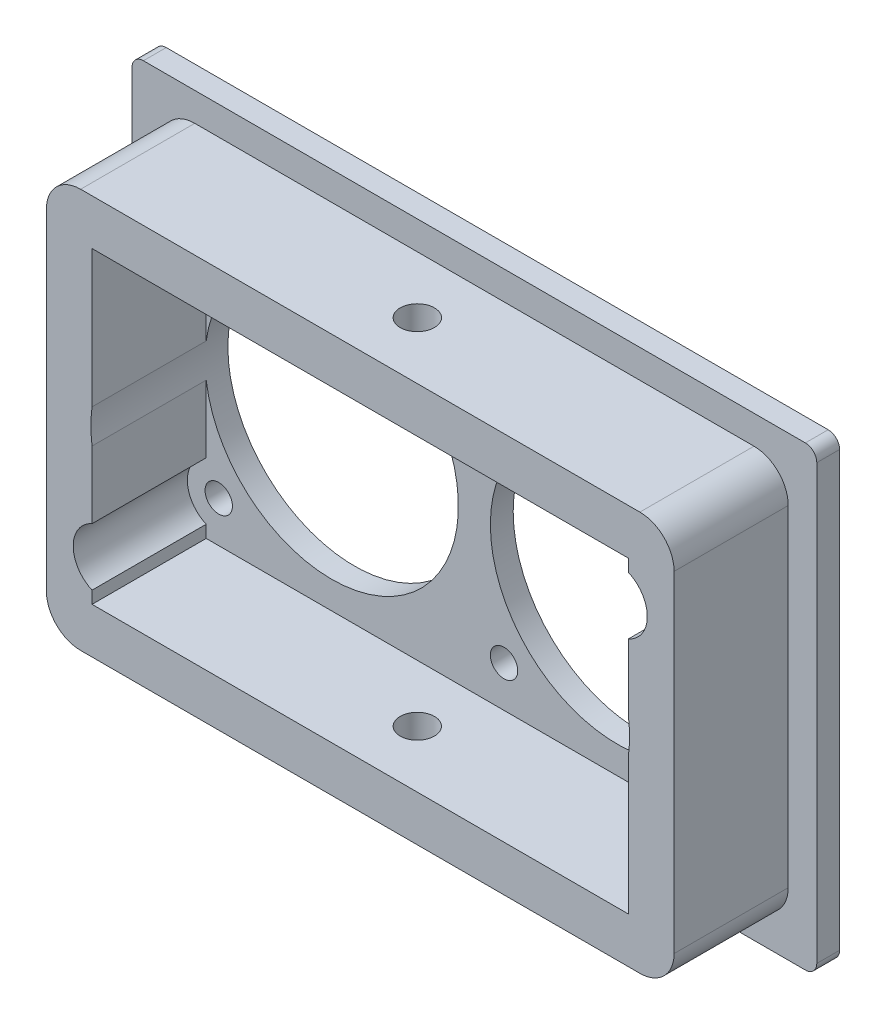
from build123d import *

# Parameters (mm, degrees)
ESQUISSE1_W             = 60
ESQUISSE1_H             = 40
BOSS_EXTRU_1_DEPTH      = 2
ESQUISSE2_W             = 55
ESQUISSE2_H             = 35
BOSS_EXTRU_2_DEPTH      = 10
CONG_1_R                = 3
CONG_2_R                = 1
ESQUISSE3_W             = 47
ESQUISSE3_H             = 27
ENL_V_MAT_EXTRU_1_DEPTH = 10
ESQUISSE4_R             = 1.5
ENL_V_MAT_EXTRU_2_DEPTH = 72.765242283
ESQUISSE5_R             = 11.1
ESQUISSE5_R_2           = 1.2
ENL_V_MAT_EXTRU_3_DEPTH = 74.10266753
ESQUISSE6_R             = 2.75
ENL_V_MAT_EXTRU_4_DEPTH = 73.801098893


with BuildPart() as part:
    # Esquisse1 → Boss.-Extru.1 (new body)
    with BuildSketch(Plane.XY):
        with Locations((30, 20)):
            Rectangle(ESQUISSE1_W, ESQUISSE1_H)
    extrude(amount=BOSS_EXTRU_1_DEPTH)

    # Esquisse2 → Boss.-Extru.2 (add)
    with BuildSketch(Plane.XY.offset(2)):
        with Locations((30, 20)):
            Rectangle(ESQUISSE2_W, ESQUISSE2_H)
    extrude(amount=BOSS_EXTRU_2_DEPTH)

    # Congé1
    cong_1_edges = [part.edges().sort_by_distance(p)[0] for p in [
        (57.5, 37.5, 7),
        (2.5, 37.5, 7),
        (2.5, 2.5, 7),
        (57.5, 2.5, 7),
    ]]
    fillet(cong_1_edges, radius=CONG_1_R)

    # Congé2
    cong_2_edges = [part.edges().sort_by_distance(p)[0] for p in [
        (0, 40, 1),
        (60, 40, 1),
        (60, 0, 1),
        (0, 0, 1),
    ]]
    fillet(cong_2_edges, radius=CONG_2_R)

    # Esquisse3 → Enlèv. mat.-Extru.1 (cut)
    with BuildSketch(Plane.XY.offset(12)):
        with Locations((30, 20)):
            Rectangle(ESQUISSE3_W, ESQUISSE3_H)
    extrude(amount=-ENL_V_MAT_EXTRU_1_DEPTH, mode=Mode.SUBTRACT)

    # Esquisse4 → Enlèv. mat.-Extru.2 (cut, through all)
    with BuildSketch(Plane(origin=(0, 37.5, 0), x_dir=(1, 0, 0), z_dir=(0, 1, 0))):
        with Locations(Location((30, -7, 0), (0, 0, 270))):
            Circle(ESQUISSE4_R)
    extrude(amount=-ENL_V_MAT_EXTRU_2_DEPTH, mode=Mode.SUBTRACT)

    # Esquisse5 → Enlèv. mat.-Extru.3 (cut, through all)
    with BuildSketch(Plane(origin=(0, 0, 0), x_dir=(-1, 0, 0), z_dir=(0, 0, -1))):
        with Locations((-42.5, 20)):
            Circle(ESQUISSE5_R)
        with Locations((-17.5, 20)):
            Circle(ESQUISSE5_R)
        with Locations((-52.4, 29.9)):
            Circle(ESQUISSE5_R_2)
        with Locations((-32.6, 10.1)):
            Circle(ESQUISSE5_R_2)
        with Locations((-27.4, 29.9)):
            Circle(ESQUISSE5_R_2)
        with Locations((-7.6, 10.1)):
            Circle(ESQUISSE5_R_2)
    extrude(amount=-ENL_V_MAT_EXTRU_3_DEPTH, mode=Mode.SUBTRACT)

    # Esquisse6 → Enlèv. mat.-Extru.4 (cut, through all)
    with BuildSketch(Plane.XY.offset(2)):
        with Locations((7.6, 10.1)):
            Circle(ESQUISSE6_R)
        with Locations((52.4, 29.9)):
            Circle(ESQUISSE6_R)
    extrude(amount=ENL_V_MAT_EXTRU_4_DEPTH, mode=Mode.SUBTRACT)


solid = part.part
